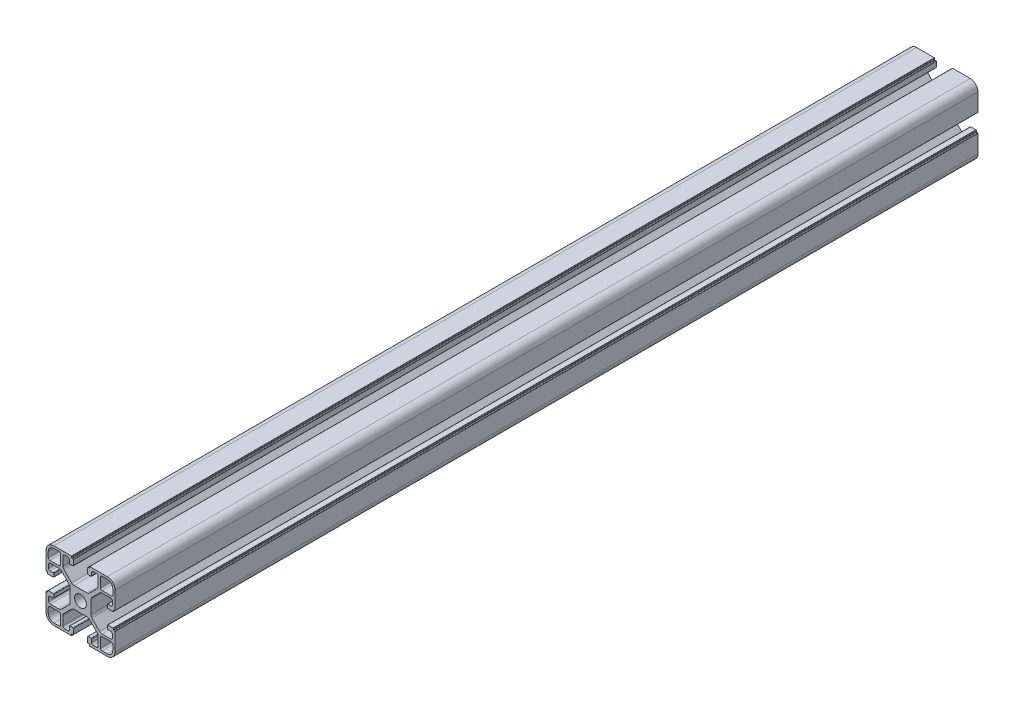
from build123d import *

# Parameters (mm, degrees)
SKETCH2_R           = 3.4
BOSS_EXTRUDE1_DEPTH = 500


with BuildPart() as part:
    # Sketch2 → Boss-Extrude1 (new body)
    with BuildSketch(Plane.XY):
        with BuildLine():
            Line((4.5, 0), (14.7, 0))
            ThreePointArc((14.7, 0), (14.841421356, 0.058578644), (14.9, 0.2))
            Line((14.9, 0.2), (14.9, 0.8))
            ThreePointArc((14.9, 0.8), (14.958578644, 0.941421356), (15.1, 1))
            Line((15.1, 1), (15.7, 1))
            ThreePointArc((15.7, 1), (15.841421356, 1.058578644), (15.9, 1.2))
            Line((15.9, 1.2), (15.9, 4.2))
            ThreePointArc((15.9, 4.2), (15.812132034, 4.412132034), (15.6, 4.5))
            Line((15.6, 4.5), (13.9, 4.5))
            ThreePointArc((13.9, 4.5), (13.687867966, 4.412132034), (13.6, 4.2))
            Line((13.6, 4.2), (13.6, 2.5))
            ThreePointArc((13.6, 2.5), (13.307106781, 1.792893219), (12.6, 1.5))
            Line((12.6, 1.5), (10.75, 1.5))
            ThreePointArc((10.75, 1.5), (10.042893219, 1.792893219), (9.75, 2.5))
            Line((9.75, 2.5), (9.75, 7.507359313))
            ThreePointArc((9.75, 7.507359313), (9.902240935, 8.272726178), (10.335786438, 8.921572875))
            Line((10.335786438, 8.921572875), (14.828427125, 13.414213562))
            ThreePointArc((14.828427125, 13.414213562), (15.477273822, 13.847759065), (16.242640687, 14))
            Line((16.242640687, 14), (23.757359313, 14))
            ThreePointArc((23.757359313, 14), (24.522726178, 13.847759065), (25.171572875, 13.414213562))
            Line((25.171572875, 13.414213562), (29.664213562, 8.921572875))
            ThreePointArc((29.664213562, 8.921572875), (30.097759065, 8.272726178), (30.25, 7.507359313))
            Line((30.25, 7.507359313), (30.25, 2.5))
            ThreePointArc((30.25, 2.5), (29.957106781, 1.792893219), (29.25, 1.5))
            Line((29.25, 1.5), (27.4, 1.5))
            ThreePointArc((27.4, 1.5), (26.692893219, 1.792893219), (26.4, 2.5))
            Line((26.4, 2.5), (26.4, 4.2))
            ThreePointArc((26.4, 4.2), (26.312132034, 4.412132034), (26.1, 4.5))
            Line((26.1, 4.5), (24.4, 4.5))
            ThreePointArc((24.4, 4.5), (24.187867966, 4.412132034), (24.1, 4.2))
            Line((24.1, 4.2), (24.1, 1.2))
            ThreePointArc((24.1, 1.2), (24.158578644, 1.058578644), (24.3, 1))
            Line((24.3, 1), (24.9, 1))
            ThreePointArc((24.9, 1), (25.041421356, 0.941421356), (25.1, 0.8))
            Line((25.1, 0.8), (25.1, 0.2))
            ThreePointArc((25.1, 0.2), (25.158578644, 0.058578644), (25.3, 0))
            Line((25.3, 0), (35.5, 0))
            ThreePointArc((35.5, 0), (38.681980515, 1.318019485), (40, 4.5))
            Line((40, 4.5), (40, 14.7))
            ThreePointArc((40, 14.7), (39.941421356, 14.841421356), (39.8, 14.9))
            Line((39.8, 14.9), (39.2, 14.9))
            ThreePointArc((39.2, 14.9), (39.058578644, 14.958578644), (39, 15.1))
            Line((39, 15.1), (39, 15.7))
            ThreePointArc((39, 15.7), (38.941421356, 15.841421356), (38.8, 15.9))
            Line((38.8, 15.9), (35.8, 15.9))
            ThreePointArc((35.8, 15.9), (35.587867966, 15.812132034), (35.5, 15.6))
            Line((35.5, 15.6), (35.5, 13.9))
            ThreePointArc((35.5, 13.9), (35.587867966, 13.687867966), (35.8, 13.6))
            Line((35.8, 13.6), (37.5, 13.6))
            ThreePointArc((37.5, 13.6), (38.207106781, 13.307106781), (38.5, 12.6))
            Line((38.5, 12.6), (38.5, 10.75))
            ThreePointArc((38.5, 10.75), (38.207106781, 10.042893219), (37.5, 9.75))
            Line((37.5, 9.75), (32.492640687, 9.75))
            ThreePointArc((32.492640687, 9.75), (31.727273822, 9.902240935), (31.078427125, 10.335786438))
            Line((31.078427125, 10.335786438), (26.585786438, 14.828427125))
            ThreePointArc((26.585786438, 14.828427125), (26.152240935, 15.477273822), (26, 16.242640687))
            Line((26, 16.242640687), (26, 23.757359313))
            ThreePointArc((26, 23.757359313), (26.152240935, 24.522726178), (26.585786438, 25.171572875))
            Line((26.585786438, 25.171572875), (31.078427125, 29.664213562))
            ThreePointArc((31.078427125, 29.664213562), (31.727273822, 30.097759065), (32.492640687, 30.25))
            Line((32.492640687, 30.25), (37.5, 30.25))
            ThreePointArc((37.5, 30.25), (38.207106781, 29.957106781), (38.5, 29.25))
            Line((38.5, 29.25), (38.5, 27.4))
            ThreePointArc((38.5, 27.4), (38.207106781, 26.692893219), (37.5, 26.4))
            Line((37.5, 26.4), (35.8, 26.4))
            ThreePointArc((35.8, 26.4), (35.587867966, 26.312132034), (35.5, 26.1))
            Line((35.5, 26.1), (35.5, 24.4))
            ThreePointArc((35.5, 24.4), (35.587867966, 24.187867966), (35.8, 24.1))
            Line((35.8, 24.1), (38.8, 24.1))
            ThreePointArc((38.8, 24.1), (38.941421356, 24.158578644), (39, 24.3))
            Line((39, 24.3), (39, 24.9))
            ThreePointArc((39, 24.9), (39.058578644, 25.041421356), (39.2, 25.1))
            Line((39.2, 25.1), (39.8, 25.1))
            ThreePointArc((39.8, 25.1), (39.941421356, 25.158578644), (40, 25.3))
            Line((40, 25.3), (40, 35.5))
            ThreePointArc((40, 35.5), (38.681980515, 38.681980515), (35.5, 40))
            Line((35.5, 40), (25.3, 40))
            ThreePointArc((25.3, 40), (25.158578644, 39.941421356), (25.1, 39.8))
            Line((25.1, 39.8), (25.1, 39.2))
            ThreePointArc((25.1, 39.2), (25.041421356, 39.058578644), (24.9, 39))
            Line((24.9, 39), (24.3, 39))
            ThreePointArc((24.3, 39), (24.158578644, 38.941421356), (24.1, 38.8))
            Line((24.1, 38.8), (24.1, 35.8))
            ThreePointArc((24.1, 35.8), (24.187867966, 35.587867966), (24.4, 35.5))
            Line((24.4, 35.5), (26.1, 35.5))
            ThreePointArc((26.1, 35.5), (26.312132034, 35.587867966), (26.4, 35.8))
            Line((26.4, 35.8), (26.4, 37.5))
            ThreePointArc((26.4, 37.5), (26.692893219, 38.207106781), (27.4, 38.5))
            Line((27.4, 38.5), (29.25, 38.5))
            ThreePointArc((29.25, 38.5), (29.957106781, 38.207106781), (30.25, 37.5))
            Line((30.25, 37.5), (30.25, 32.492640687))
            ThreePointArc((30.25, 32.492640687), (30.097759065, 31.727273822), (29.664213562, 31.078427125))
            Line((29.664213562, 31.078427125), (25.171572875, 26.585786438))
            ThreePointArc((25.171572875, 26.585786438), (24.522726178, 26.152240935), (23.757359313, 26))
            Line((23.757359313, 26), (16.242640687, 26))
            ThreePointArc((16.242640687, 26), (15.477273822, 26.152240935), (14.828427125, 26.585786438))
            Line((14.828427125, 26.585786438), (10.335786438, 31.078427125))
            ThreePointArc((10.335786438, 31.078427125), (9.902240935, 31.727273822), (9.75, 32.492640687))
            Line((9.75, 32.492640687), (9.75, 37.5))
            ThreePointArc((9.75, 37.5), (10.042893219, 38.207106781), (10.75, 38.5))
            Line((10.75, 38.5), (12.6, 38.5))
            ThreePointArc((12.6, 38.5), (13.307106781, 38.207106781), (13.6, 37.5))
            Line((13.6, 37.5), (13.6, 35.8))
            ThreePointArc((13.6, 35.8), (13.687867966, 35.587867966), (13.9, 35.5))
            Line((13.9, 35.5), (15.6, 35.5))
            ThreePointArc((15.6, 35.5), (15.812132034, 35.587867966), (15.9, 35.8))
            Line((15.9, 35.8), (15.9, 38.8))
            ThreePointArc((15.9, 38.8), (15.841421356, 38.941421356), (15.7, 39))
            Line((15.7, 39), (15.1, 39))
            ThreePointArc((15.1, 39), (14.958578644, 39.058578644), (14.9, 39.2))
            Line((14.9, 39.2), (14.9, 39.8))
            ThreePointArc((14.9, 39.8), (14.841421356, 39.941421356), (14.7, 40))
            Line((14.7, 40), (4.5, 40))
            ThreePointArc((4.5, 40), (1.318019485, 38.681980515), (0, 35.5))
            Line((0, 35.5), (0, 25.3))
            ThreePointArc((0, 25.3), (0.058578644, 25.158578644), (0.2, 25.1))
            Line((0.2, 25.1), (0.8, 25.1))
            ThreePointArc((0.8, 25.1), (0.941421356, 25.041421356), (1, 24.9))
            Line((1, 24.9), (1, 24.3))
            ThreePointArc((1, 24.3), (1.058578644, 24.158578644), (1.2, 24.1))
            Line((1.2, 24.1), (4.2, 24.1))
            ThreePointArc((4.2, 24.1), (4.412132034, 24.187867966), (4.5, 24.4))
            Line((4.5, 24.4), (4.5, 26.1))
            ThreePointArc((4.5, 26.1), (4.412132034, 26.312132034), (4.2, 26.4))
            Line((4.2, 26.4), (2.5, 26.4))
            ThreePointArc((2.5, 26.4), (1.792893219, 26.692893219), (1.5, 27.4))
            Line((1.5, 27.4), (1.5, 29.25))
            ThreePointArc((1.5, 29.25), (1.792893219, 29.957106781), (2.5, 30.25))
            Line((2.5, 30.25), (7.507359313, 30.25))
            ThreePointArc((7.507359313, 30.25), (8.272726178, 30.097759065), (8.921572875, 29.664213562))
            Line((8.921572875, 29.664213562), (13.414213562, 25.171572875))
            ThreePointArc((13.414213562, 25.171572875), (13.847759065, 24.522726178), (14, 23.757359313))
            Line((14, 23.757359313), (14, 16.242640687))
            ThreePointArc((14, 16.242640687), (13.847759065, 15.477273822), (13.414213562, 14.828427125))
            Line((13.414213562, 14.828427125), (8.921572875, 10.335786438))
            ThreePointArc((8.921572875, 10.335786438), (8.272726178, 9.902240935), (7.507359313, 9.75))
            Line((7.507359313, 9.75), (2.5, 9.75))
            ThreePointArc((2.5, 9.75), (1.792893219, 10.042893219), (1.5, 10.75))
            Line((1.5, 10.75), (1.5, 12.6))
            ThreePointArc((1.5, 12.6), (1.792893219, 13.307106781), (2.5, 13.6))
            Line((2.5, 13.6), (4.2, 13.6))
            ThreePointArc((4.2, 13.6), (4.412132034, 13.687867966), (4.5, 13.9))
            Line((4.5, 13.9), (4.5, 15.6))
            ThreePointArc((4.5, 15.6), (4.412132034, 15.812132034), (4.2, 15.9))
            Line((4.2, 15.9), (1.2, 15.9))
            ThreePointArc((1.2, 15.9), (1.058578644, 15.841421356), (1, 15.7))
            Line((1, 15.7), (1, 15.1))
            ThreePointArc((1, 15.1), (0.941421356, 14.958578644), (0.8, 14.9))
            Line((0.8, 14.9), (0.2, 14.9))
            ThreePointArc((0.2, 14.9), (0.058578644, 14.841421356), (0, 14.7))
            Line((0, 14.7), (0, 4.5))
            ThreePointArc((0, 4.5), (1.318019485, 1.318019485), (4.5, 0))
        make_face()
        with Locations((20, 20)):
            Circle(SKETCH2_R, mode=Mode.SUBTRACT)
        with BuildLine():
            Line((31.55, 37.7), (31.55, 32.55))
            ThreePointArc((31.55, 32.55), (31.842893219, 31.842893219), (32.55, 31.55))
            Line((32.55, 31.55), (37.7, 31.55))
            ThreePointArc((37.7, 31.55), (38.407106781, 31.842893219), (38.7, 32.55))
            Line((38.7, 32.55), (38.7, 35.5))
            ThreePointArc((38.7, 35.5), (37.7627417, 37.7627417), (35.5, 38.7))
            Line((35.5, 38.7), (32.55, 38.7))
            ThreePointArc((32.55, 38.7), (31.842893219, 38.407106781), (31.55, 37.7))
        make_face(mode=Mode.SUBTRACT)
        with BuildLine():
            Line((1.3, 35.5), (1.3, 32.55))
            ThreePointArc((1.3, 32.55), (1.592893219, 31.842893219), (2.3, 31.55))
            Line((2.3, 31.55), (7.45, 31.55))
            ThreePointArc((7.45, 31.55), (8.157106781, 31.842893219), (8.45, 32.55))
            Line((8.45, 32.55), (8.45, 37.7))
            ThreePointArc((8.45, 37.7), (8.157106781, 38.407106781), (7.45, 38.7))
            Line((7.45, 38.7), (4.5, 38.7))
            ThreePointArc((4.5, 38.7), (2.2372583, 37.7627417), (1.3, 35.5))
        make_face(mode=Mode.SUBTRACT)
        with BuildLine():
            Line((1.3, 7.45), (1.3, 4.5))
            ThreePointArc((1.3, 4.5), (2.2372583, 2.2372583), (4.5, 1.3))
            Line((4.5, 1.3), (7.45, 1.3))
            ThreePointArc((7.45, 1.3), (8.157106781, 1.592893219), (8.45, 2.3))
            Line((8.45, 2.3), (8.45, 7.45))
            ThreePointArc((8.45, 7.45), (8.157106781, 8.157106781), (7.45, 8.45))
            Line((7.45, 8.45), (2.3, 8.45))
            ThreePointArc((2.3, 8.45), (1.592893219, 8.157106781), (1.3, 7.45))
        make_face(mode=Mode.SUBTRACT)
        with BuildLine():
            Line((31.55, 7.45), (31.55, 2.3))
            ThreePointArc((31.55, 2.3), (31.842893219, 1.592893219), (32.55, 1.3))
            Line((32.55, 1.3), (35.5, 1.3))
            ThreePointArc((35.5, 1.3), (37.7627417, 2.2372583), (38.7, 4.5))
            Line((38.7, 4.5), (38.7, 7.45))
            ThreePointArc((38.7, 7.45), (38.407106781, 8.157106781), (37.7, 8.45))
            Line((37.7, 8.45), (32.55, 8.45))
            ThreePointArc((32.55, 8.45), (31.842893219, 8.157106781), (31.55, 7.45))
        make_face(mode=Mode.SUBTRACT)
    extrude(amount=BOSS_EXTRUDE1_DEPTH)


solid = part.part
